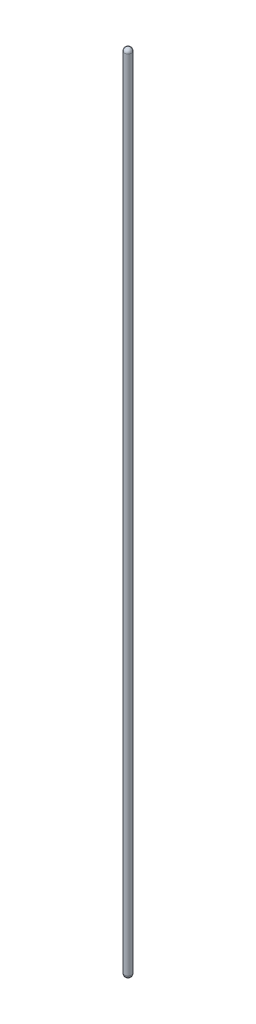
from build123d import *


with BuildPart() as part:
    # Sketch3 → Revolve4 (revolve)
    with BuildSketch(Plane.XY, mode=Mode.PRIVATE) as revolve4_sk:
        with BuildLine():
            Line((-9, 1000), (-9, -1000))
            ThreePointArc((-9, -1000), (-6.363961031, -1006.363961031), (0, -1009))
            Line((0, -1009), (0, 1009))
            ThreePointArc((0, 1009), (-6.363961031, 1006.363961031), (-9, 1000))
        make_face()
    revolve(revolve4_sk.sketch.rotate(Axis((0, 3.935413525, 0), (0, -1, 0)), 270), axis=Axis((0, 3.935413525, 0), (0, -1, 0)))


solid = part.part
